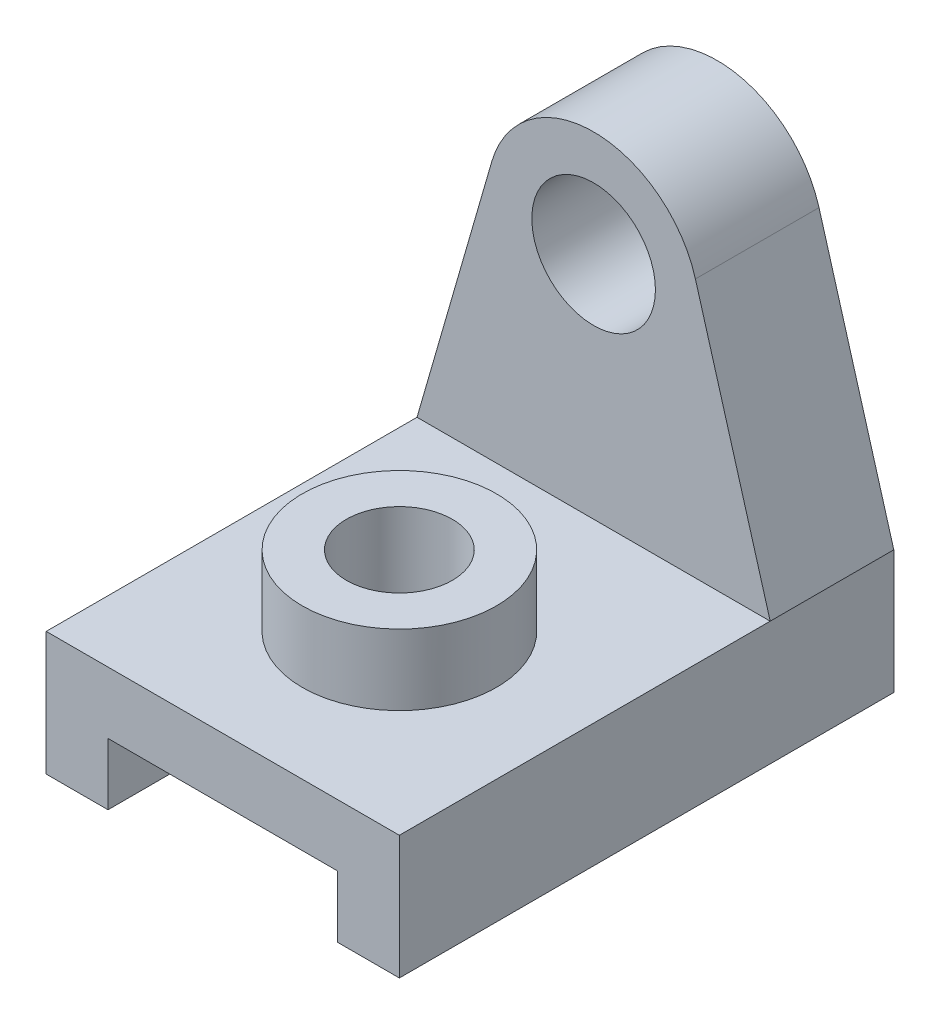
from build123d import *

# Parameters (mm, degrees)
SKETCH1_W                = 40
SKETCH1_H                = 56
BOSS_EXTRUDE1_DEPTH      = 14
SKETCH5_W                = 13
SKETCH5_H                = 7
CUT_EXTRUDE1_DEPTH       = 68
SKETCH7_R                = 7
BOSS_EXTRUDE2_DEPTH      = 14
BOSS_EXTRUDE3_DEPTH      = 8
BOSS_EXTRUDE3_DEPTH_BACK = 1
SKETCH8_R                = 11
SKETCH9_R                = 6
CUT_EXTRUDE2_DEPTH       = 44


with BuildPart() as part:
    # Sketch1 → Boss-Extrude1 (new body)
    with BuildSketch(Plane(origin=(0, 0, 0), x_dir=(1, 0, 0), z_dir=(0, 1, 0))):
        with Locations((0, -28)):
            Rectangle(SKETCH1_W, SKETCH1_H)
    extrude(amount=BOSS_EXTRUDE1_DEPTH)

    # Sketch5 → Cut-Extrude1 (cut)
    with BuildSketch(Plane.XY):
        with Locations((6.5, 3.5)):
            Rectangle(SKETCH5_W, SKETCH5_H)
        with Locations((-6.5, 3.5)):
            Rectangle(SKETCH5_W, SKETCH5_H)
    extrude(amount=CUT_EXTRUDE1_DEPTH, mode=Mode.SUBTRACT)

    # Sketch7 → Boss-Extrude2 (add)
    with BuildSketch(Plane.XY):
        with BuildLine():
            Line((20, 14), (-20, 14))
            Line((-20, 14), (-11.528805322, 43.329811826))
            ThreePointArc((-11.528805322, 43.329811826), (0, 52.000041623), (11.528805322, 43.329811826))
            Line((11.528805322, 43.329811826), (20, 14))
        make_face()
        with Locations((0, 40)):
            Circle(SKETCH7_R, mode=Mode.SUBTRACT)
    extrude(amount=BOSS_EXTRUDE2_DEPTH)

    # Sketch8 → Boss-Extrude3 (add, two sides: drawn at the far end of the back side and taken through both)
    with BuildSketch(Plane(origin=(0, 14, 0), x_dir=(1, 0, 0), z_dir=(0, 1, 0)).offset(-BOSS_EXTRUDE3_DEPTH_BACK)):
        with Locations(Location((0, -36, 0), (0, 0, 270))):
            Circle(SKETCH8_R)
    extrude(amount=BOSS_EXTRUDE3_DEPTH + BOSS_EXTRUDE3_DEPTH_BACK)

    # Sketch9 → Cut-Extrude2 (cut)
    with BuildSketch(Plane(origin=(0, 22, 0), x_dir=(1, 0, 0), z_dir=(0, 1, 0))):
        with Locations(Location((0, -36, 0), (0, 0, 270))):
            Circle(SKETCH9_R)
    extrude(amount=-CUT_EXTRUDE2_DEPTH, mode=Mode.SUBTRACT)


solid = part.part
